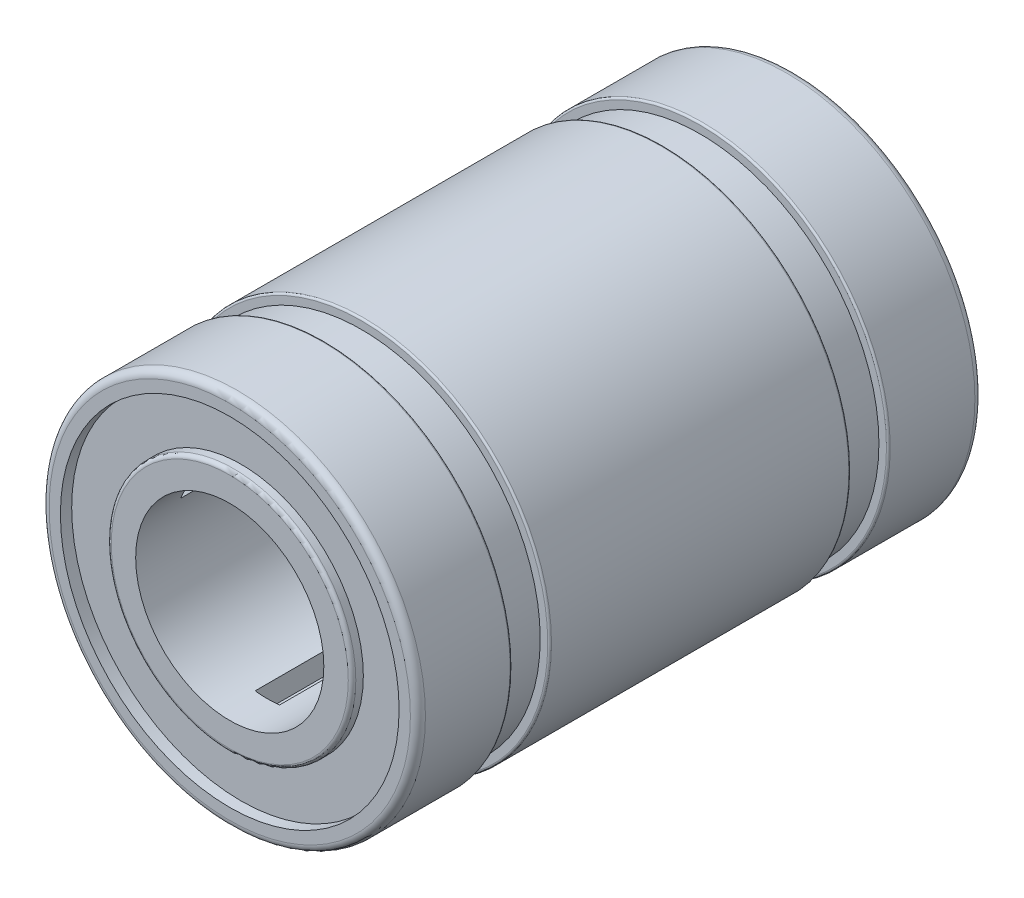
from build123d import *

# Parameters (mm, degrees)
BOSS_EXTRUDE1_DEPTH      = 4
BOSS_EXTRUDE1_DEPTH_BACK = 4
SKETCH1_R                = 5
BOSS_EXTRUDE2_DEPTH      = 1
BOSS_EXTRUDE2_DEPTH_BACK = 9
SKETCH2_R                = 4.75
SKETCH3_R                = 5
BOSS_EXTRUDE3_DEPTH      = 2.5
BOSS_EXTRUDE4_START      = 2.5
SKETCH4_R                = 5
BOSS_EXTRUDE4_DEPTH      = 2.5
SKETCH5_R                = 4.5
CUT_EXTRUDE1_DEPTH       = 0.3
CUT_EXTRUDE2_START       = -0.3
SKETCH6_R                = 4.5
CUT_EXTRUDE2_DEPTH       = 0.3
SKETCH7_R                = 3.25
BOSS_EXTRUDE5_DEPTH      = 0.3
BOSS_EXTRUDE6_START      = 0.3
SKETCH8_R                = 3.25
BOSS_EXTRUDE6_DEPTH      = 0.3
SKETCH9_R                = 2.5
CUT_EXTRUDE3_DEPTH       = 20.3
SKETCH10_W               = 0.64983534
SKETCH10_H               = 1.129620884
CUT_EXTRUDE4_DEPTH       = 14
BOSS_EXTRUDE7_START      = -1
SKETCH11_R               = 3.25
SKETCH11_R_2             = 2.5
BOSS_EXTRUDE7_DEPTH      = 1
FILLET1_R                = 0.2
FILLET2_R                = 0.05
FILLET3_R                = 0.1


with BuildPart() as part:
    # Sketch1 → Boss-Extrude1 (new, two sides: drawn at the far end of the back side and taken through both)
    with BuildSketch(Plane.XY.offset(-BOSS_EXTRUDE1_DEPTH_BACK)):
        Circle(SKETCH1_R)
    extrude(amount=BOSS_EXTRUDE1_DEPTH + BOSS_EXTRUDE1_DEPTH_BACK)

    # Sketch2 → Boss-Extrude2 (add, two sides: drawn at the far end of the back side and taken through both)
    with BuildSketch(Plane.XY.offset(4).offset(-BOSS_EXTRUDE2_DEPTH_BACK)):
        Circle(SKETCH2_R)
    extrude(amount=BOSS_EXTRUDE2_DEPTH + BOSS_EXTRUDE2_DEPTH_BACK)

    # Sketch3 → Boss-Extrude3 (add)
    with BuildSketch(Plane.XY.offset(5)):
        Circle(SKETCH3_R)
    extrude(amount=BOSS_EXTRUDE3_DEPTH)

    # Sketch4 → Boss-Extrude4 (add)
    with BuildSketch(Plane(origin=(0, 0, -5), x_dir=(-1, 0, 0), z_dir=(0, 0, -1)).offset(BOSS_EXTRUDE4_START)):
        Circle(SKETCH4_R)
    extrude(amount=-BOSS_EXTRUDE4_DEPTH)

    # Sketch5 → Cut-Extrude1 (cut)
    with BuildSketch(Plane.XY.offset(7.5)):
        Circle(SKETCH5_R)
    extrude(amount=-CUT_EXTRUDE1_DEPTH, mode=Mode.SUBTRACT)

    # Sketch6 → Cut-Extrude2 (cut)
    with BuildSketch(Plane(origin=(0, 0, -7.5), x_dir=(-1, 0, 0), z_dir=(0, 0, -1)).offset(CUT_EXTRUDE2_START)):
        Circle(SKETCH6_R)
    extrude(amount=CUT_EXTRUDE2_DEPTH, mode=Mode.SUBTRACT)

    # Sketch7 → Boss-Extrude5 (add)
    with BuildSketch(Plane(origin=(0, 0, -7.2), x_dir=(-1, 0, 0), z_dir=(0, 0, -1))):
        Circle(SKETCH7_R)
    extrude(amount=BOSS_EXTRUDE5_DEPTH)

    # Sketch8 → Boss-Extrude6 (add)
    with BuildSketch(Plane.XY.offset(7.2).offset(BOSS_EXTRUDE6_START)):
        Circle(SKETCH8_R)
    extrude(amount=-BOSS_EXTRUDE6_DEPTH)

    # Sketch9 → Cut-Extrude3 (cut)
    with BuildSketch(Plane(origin=(0, 0, -7.5), x_dir=(-1, 0, 0), z_dir=(0, 0, -1))):
        Circle(SKETCH9_R)
    extrude(amount=-CUT_EXTRUDE3_DEPTH, mode=Mode.SUBTRACT)

    # Sketch10 → Cut-Extrude4 (cut)
    with BuildSketch(Plane(origin=(0, 0, -7.5), x_dir=(-1, 0, 0), z_dir=(0, 0, -1))):
        with Locations((0, -2.5)):
            Rectangle(SKETCH10_W, SKETCH10_H)
        Polygon((-1.513464483, 1.248981736), (-2.491744865, 1.813792177), (-2.816662536, 1.251018264), (-1.838382154, 0.686207823), align=None)
        Polygon((1.838382154, 0.686207823), (2.816662536, 1.251018264), (2.491744865, 1.813792177), (1.513464483, 1.248981736), align=None)
    extrude(amount=-CUT_EXTRUDE4_DEPTH, mode=Mode.SUBTRACT)

    # Sketch11 → Boss-Extrude7 (add)
    with BuildSketch(Plane(origin=(0, 0, -7.5), x_dir=(-1, 0, 0), z_dir=(0, 0, -1)).offset(BOSS_EXTRUDE7_START)):
        Circle(SKETCH11_R)
        Circle(SKETCH11_R_2, mode=Mode.SUBTRACT)
    extrude(amount=BOSS_EXTRUDE7_DEPTH)

    # Fillet1
    fillet1_edges = [part.edges().sort_by_distance(p)[0] for p in [
        (-5, 0, 7.5),
        (5, 0, -7.5),
    ]]
    fillet(fillet1_edges, radius=FILLET1_R)

    # Fillet2
    fillet2_edges = [part.edges().sort_by_distance(p)[0] for p in [
        (-5, 0, 5),
        (-5, 0, 4),
        (-5, 0, -4),
        (5, 0, -5),
    ]]
    fillet(fillet2_edges, radius=FILLET2_R)

    # Fillet3
    fillet3_edges = [part.edges().sort_by_distance(p)[0] for p in [
        (-3.25, 0, 7.5),
        (3.25, 0, -7.5),
    ]]
    fillet(fillet3_edges, radius=FILLET3_R)


solid = part.part
